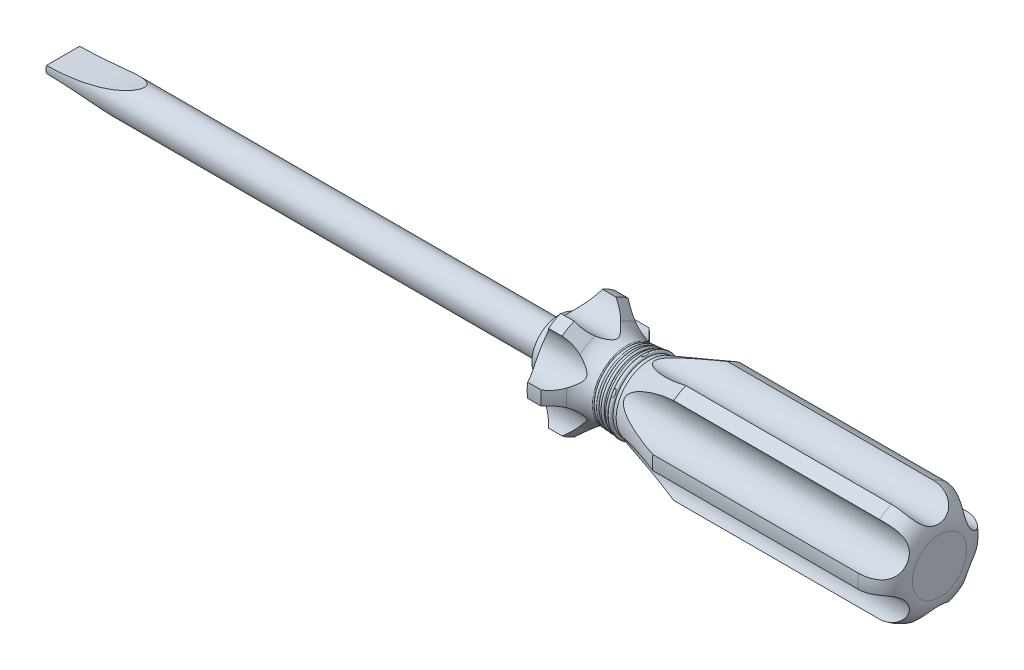
from build123d import *

# Parameters (mm, degrees)
SKETCH8_R           = 0.1
SKETCH9_R           = 0.15
SKETCH11_R          = 0.2
SKETCH13_R          = 0.2
SKETCH14_R          = 0.288807548
SKETCH15_R          = 3.271649525
CUT_EXTRUDE4_DEPTH  = 58.131427554
CIRPATTERN1_COUNT   = 6
SKETCH23_R          = 2.5
BOSS_EXTRUDE7_DEPTH = 73
CUT_EXTRUDE8_DEPTH  = 36.5


with BuildPart() as part:
    # Sketch1 → Revolve1 (revolve)
    with BuildSketch(Plane(origin=(0, 0, 0), x_dir=(1, 0, 0), z_dir=(0, 1, 0))):
        with BuildLine():
            Line((0, 0), (0, 4))
            Line((0, 4), (1, 4))
            Line((1, 4), (3.309401077, 8))
            Line((3.309401077, 8), (5.309401077, 8))
            Line((5.309401077, 8), (7.18674764, 6.122653437))
            ThreePointArc((7.18674764, 6.122653437), (8.484441035, 5.255562432), (10.015174765, 4.951080562))
            Line((10.015174765, 4.951080562), (13.358320515, 4.951080562))
            Line((13.358320515, 4.951080562), (21.735157825, 8))
            Line((21.735157825, 8), (52, 8))
            ThreePointArc((52, 8), (54.828427125, 6.828427125), (56, 4))
            Line((56, 4), (56, 0))
            Line((56, 0), (0, 0))
        make_face()
    revolve(axis=Axis((56, 0, 0), (-1, 0, 0)))

    # Sketch8 → Revolve8 (revolve)
    with BuildSketch(Plane.XY, mode=Mode.PRIVATE) as revolve8_sk:
        with Locations((10.015174765, 4.951080562)):
            Circle(SKETCH8_R)
    revolve(revolve8_sk.sketch.rotate(Axis((10.015174765, 0, 0), (1, 0, 0)), 270), axis=Axis((10.015174765, 0, 0), (1, 0, 0)))

    # Sketch9 → Revolve9 (revolve)
    with BuildSketch(Plane.XY, mode=Mode.PRIVATE) as revolve9_sk:
        with Locations((10.698226843, 4.951080562)):
            Circle(SKETCH9_R)
    revolve(revolve9_sk.sketch.rotate(Axis((10.698226843, 0, 0), (1, 0, 0)), 270), axis=Axis((10.698226843, 0, 0), (1, 0, 0)))

    # Sketch11 → Revolve13 (revolve)
    with BuildSketch(Plane.XY, mode=Mode.PRIVATE) as revolve13_sk:
        with Locations((15.90477895, 4.951080562)):
            Circle(SKETCH11_R)
        with Locations((11.419134057, 4.951080562)):
            Circle(SKETCH11_R)
    revolve(revolve13_sk.sketch.rotate(Axis((11.419134057, 0, 0), (1, 0, 0)), 270), axis=Axis((11.419134057, 0, 0), (1, 0, 0)))

    # Sketch13 → Revolve14 (revolve)
    with BuildSketch(Plane.XY, mode=Mode.PRIVATE) as revolve14_sk:
        with Locations((12.140041272, 5.006300103)):
            Circle(SKETCH13_R)
    revolve(revolve14_sk.sketch.rotate(Axis((12.140041272, 0, 0), (1, 0, 0)), 270), axis=Axis((12.140041272, 0, 0), (1, 0, 0)))

    # Sketch14 → Revolve15 (revolve)
    with BuildSketch(Plane.XY, mode=Mode.PRIVATE) as revolve15_sk:
        with Locations((12.620646082, 5.006300103)):
            Circle(SKETCH14_R)
    revolve(revolve15_sk.sketch.rotate(Axis((12.620646082, 0, 0), (1, 0, 0)), 270), axis=Axis((12.620646082, 0, 0), (1, 0, 0)))

    # Sketch15 → Cut-Extrude4 (cut, through all)
    with BuildSketch(Plane.ZY):
        with Locations((0, 8.49896793)):
            Circle(SKETCH15_R)
    cut_extrude4 = extrude(amount=-CUT_EXTRUDE4_DEPTH, mode=Mode.SUBTRACT)

    # CirPattern1: Cut-Extrude4 ×6 about axis
    cirpattern1_axis = Axis((0, 0, 0), (1, 0, 0))
    for i in range(1, CIRPATTERN1_COUNT):
        add(cut_extrude4.rotate(cirpattern1_axis, i * 360 / CIRPATTERN1_COUNT), mode=Mode.SUBTRACT)

    # Sketch23 → Boss-Extrude7 (add)
    with BuildSketch(Plane.ZY):
        Circle(SKETCH23_R)
    extrude(amount=BOSS_EXTRUDE7_DEPTH)

    # Sketch31 → Cut-Extrude8 (cut, symmetric)
    with BuildSketch(Plane.XY):
        with BuildLine():
            Line((-73, 0.5), (-73, 2.5))
            Line((-73, 2.5), (-61, 2.5))
            ThreePointArc((-61, 2.5), (-66.925397703, 1.05238622), (-73, 0.5))
        make_face()
        with BuildLine():
            Line((-73, -2.5), (-61, -2.5))
            ThreePointArc((-61, -2.5), (-66.925397703, -1.05238622), (-73, -0.5))
            Line((-73, -0.5), (-73, -2.5))
        make_face()
    extrude(amount=CUT_EXTRUDE8_DEPTH, both=True, mode=Mode.SUBTRACT)


solid = part.part
